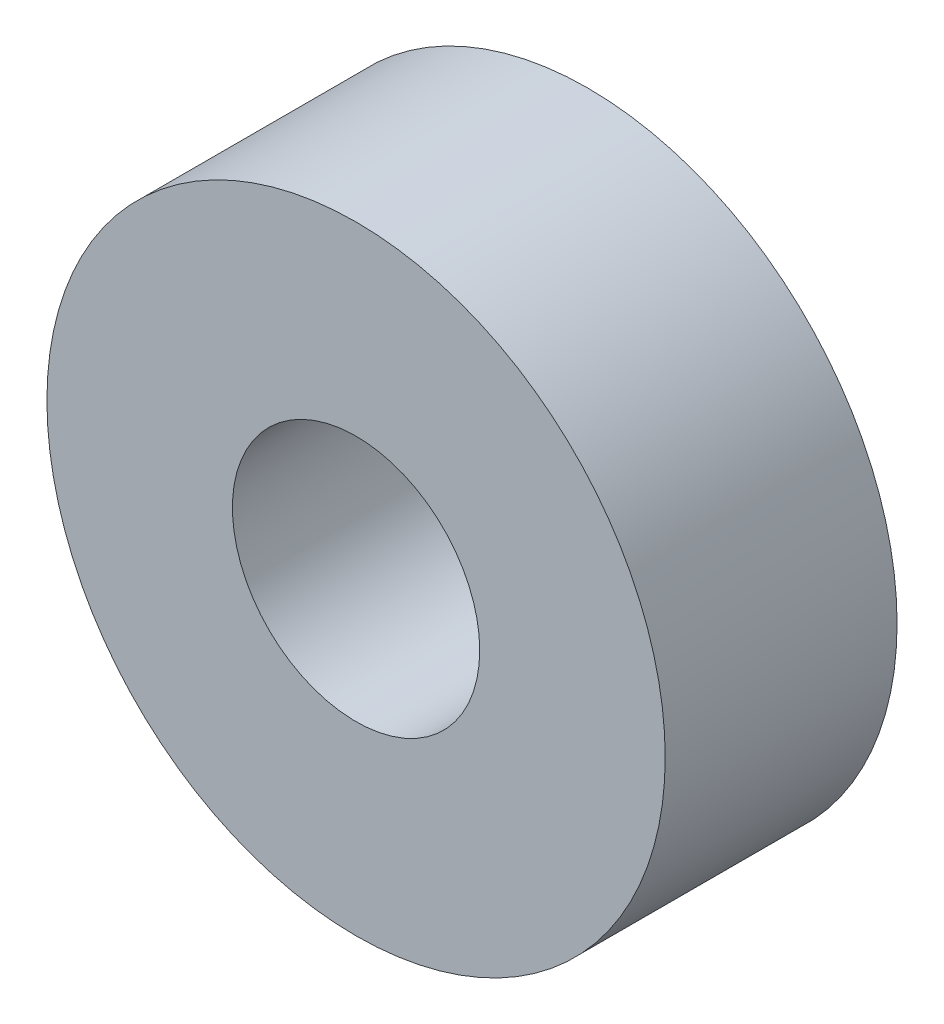
from build123d import *

# Parameters (mm, degrees)
SKETCH1_R      = 4
SKETCH1_R_2    = 1.6
EXTRUDE1_DEPTH = 1.5


with BuildPart() as part:
    # Sketch1 → Extrude1 (new, symmetric)
    with BuildSketch(Plane.XY):
        Circle(SKETCH1_R)
        Circle(SKETCH1_R_2, mode=Mode.SUBTRACT)
    extrude(amount=EXTRUDE1_DEPTH, both=True)


solid = part.part
